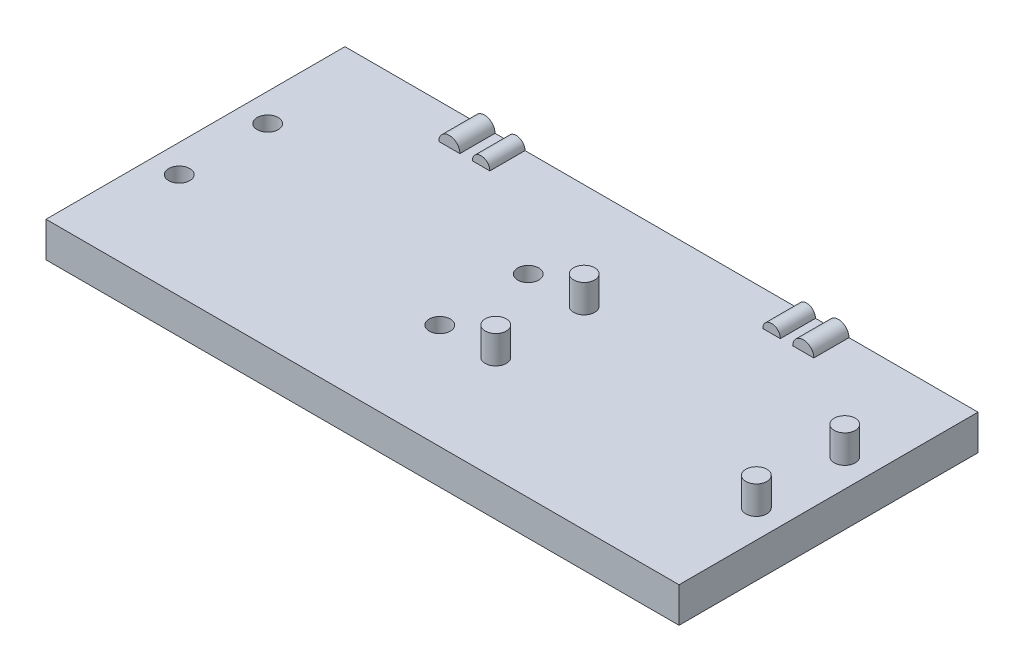
from build123d import *

# Parameters (mm, degrees)
SCHIZZO1_W                   = 180
SCHIZZO1_H                   = 85
ESTRUSIONE_ESTRUSIONE1_DEPTH = 10
SCHIZZO5_R                   = 3
ESTRUSIONE_ESTRUSIONE3_DEPTH = 8
SCHIZZO5_3_R                 = 3
TAGLIO_ESTRUSIONE1_DEPTH     = 8
ESTRUSIONE_ESTRUSIONE4_DEPTH = 10


with BuildPart() as part:
    # Schizzo1 → Estrusione-Estrusione1 (new body)
    with BuildSketch(Plane(origin=(0, 0, 0), x_dir=(1, 0, 0), z_dir=(0, 1, 0))):
        Rectangle(SCHIZZO1_W, SCHIZZO1_H)
    extrude(amount=ESTRUSIONE_ESTRUSIONE1_DEPTH)

    # Schizzo5 → Estrusione-Estrusione3 (add)
    with BuildSketch(Plane(origin=(0, 10, 0), x_dir=(1, 0, 0), z_dir=(0, 1, 0))):
        with Locations((82.045349051, -12.571464774)):
            Circle(SCHIZZO5_R)
        with Locations((82.045349051, 12.571464774)):
            Circle(SCHIZZO5_R)
        with Locations((7.954650949, -12.571464774)):
            Circle(SCHIZZO5_R)
        with Locations((7.954650949, 12.571464774)):
            Circle(SCHIZZO5_R)
    extrude(amount=ESTRUSIONE_ESTRUSIONE3_DEPTH)

    # Schizzo5<3> → Taglio-Estrusione1 (cut)
    with BuildSketch(Plane(origin=(0, 10, 0), x_dir=(1, 0, 0), z_dir=(0, 1, 0))):
        with Locations((-82.045349051, 12.571464774)):
            Circle(SCHIZZO5_3_R)
        with Locations((-82.045349051, -12.571464774)):
            Circle(SCHIZZO5_3_R)
        with Locations((-7.954650949, -12.571464774)):
            Circle(SCHIZZO5_3_R)
        with Locations((-7.954650949, 12.571464774)):
            Circle(SCHIZZO5_3_R)
    extrude(amount=-TAGLIO_ESTRUSIONE1_DEPTH, mode=Mode.SUBTRACT)

    # Schizzo6 → Estrusione-Estrusione4 (add)
    with BuildSketch(Plane(origin=(0, 0, -42.5), x_dir=(-1, 0, 0), z_dir=(0, 0, -1))):
        with BuildLine():
            Line((-53.319235265, 10), (-47.319235265, 10))
            ThreePointArc((-47.319235265, 10), (-50.319235265, 13), (-53.319235265, 10))
        make_face()
        with BuildLine():
            Line((-43.794702793, 10), (-38.794702793, 10))
            ThreePointArc((-38.794702793, 10), (-41.294702793, 12.5), (-43.794702793, 10))
        make_face()
        with BuildLine():
            Line((43.794702793, 10), (38.794702793, 10))
            ThreePointArc((38.794702793, 10), (41.294702793, 12.5), (43.794702793, 10))
        make_face()
        with BuildLine():
            Line((53.319235265, 10), (47.319235265, 10))
            ThreePointArc((47.319235265, 10), (50.319235265, 13), (53.319235265, 10))
        make_face()
    extrude(amount=-ESTRUSIONE_ESTRUSIONE4_DEPTH)


solid = part.part
